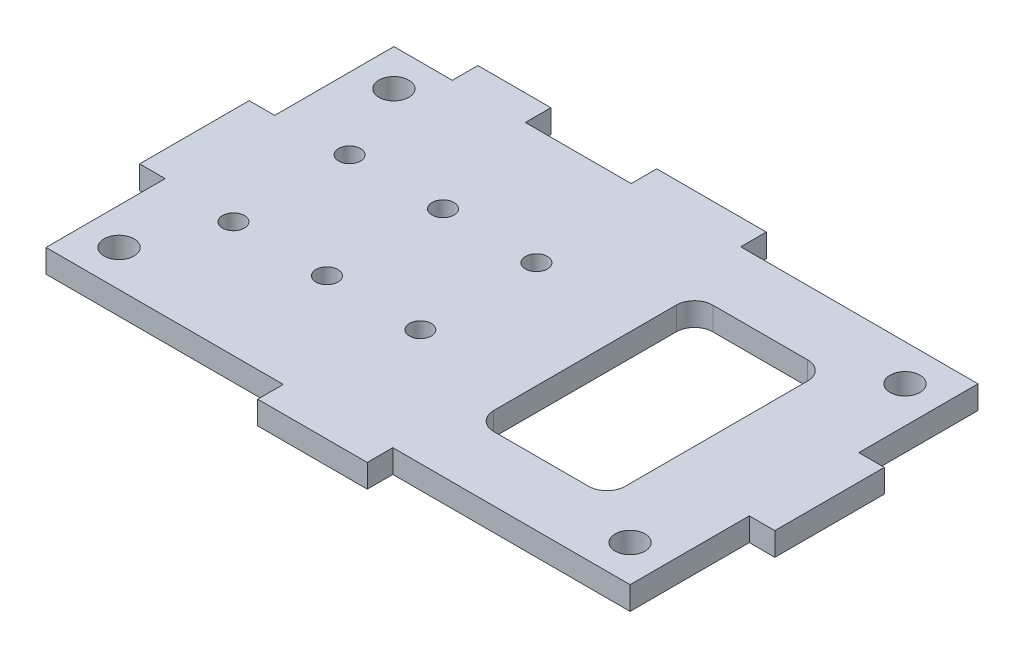
from build123d import *

# Parameters (mm, degrees)
SKETCH2_W               = 80
SKETCH2_H               = 47.65
BOSS_EXTRUDE1_DEPTH     = 3.175
SKETCH3_W               = 15
SKETCH3_H               = 3.5
BOSS_EXTRUDE2_DEPTH     = 3.175
SKETCH4_W               = 3.5
SKETCH4_H               = 15
BOSS_EXTRUDE3_DEPTH     = 3.175
MIRROR2_COPY_1_SKETCH_W = 3.5
MIRROR2_COPY_1_SKETCH_H = 15
MIRROR2_COPY_1_DEPTH    = 3.175
MIRROR2_COPY_2_SKETCH_W = 3.5
MIRROR2_COPY_2_SKETCH_H = 15
MIRROR2_COPY_2_DEPTH    = 3.175
SKETCH5_R               = 2.05
CUT_EXTRUDE1_DEPTH      = 20
SKETCH6_W               = 18
SKETCH6_H               = 30
CUT_EXTRUDE2_DEPTH      = 52.468303353
FILLET1_R               = 2.5
MIRROR4_COPY_1_SKETCH_R = 2.05
MIRROR4_COPY_1_DEPTH    = 20
SKETCH8_R               = 1.5
CUT_EXTRUDE4_DEPTH      = 10
LPATTERN1_COUNT         = 3
LPATTERN1_PITCH         = 12.8
MIRROR5_COPY_1_SKETCH_R = 1.5
MIRROR5_COPY_1_DEPTH    = 10
MIRROR5_COPY_2_SKETCH_R = 1.5
MIRROR5_COPY_2_DEPTH    = 10
SKETCH9_W               = 10
SKETCH9_H               = 3.5
BOSS_EXTRUDE4_DEPTH     = 3.175


with BuildPart() as part:
    # Sketch2 → Boss-Extrude1 (new body)
    with BuildSketch(Plane(origin=(0, 0, 0), x_dir=(1, 0, 0), z_dir=(0, 1, 0))):
        Rectangle(SKETCH2_W, SKETCH2_H)
    extrude(amount=BOSS_EXTRUDE1_DEPTH)

    # Sketch3 → Boss-Extrude2 (add)
    with BuildSketch(Plane(origin=(0, 3.175, 0), x_dir=(1, 0, 0), z_dir=(0, 1, 0))):
        with Locations((0, 25.575)):
            Rectangle(SKETCH3_W, SKETCH3_H)
    boss_extrude2 = extrude(amount=-BOSS_EXTRUDE2_DEPTH)

    # Sketch4 → Boss-Extrude3 (add)
    with BuildSketch(Plane(origin=(0, 3.175, 0), x_dir=(1, 0, 0), z_dir=(0, 1, 0))):
        with Locations((-41.75, 0)):
            Rectangle(SKETCH4_W, SKETCH4_H)
    boss_extrude3 = extrude(amount=-BOSS_EXTRUDE3_DEPTH)

    # Mirror1: Boss-Extrude3 across plane
    add(boss_extrude3.mirror(Plane(origin=(0, 0, 0), x_dir=(0, 0, 1), z_dir=(1, 0, 0))))

    # Mirror2: Boss-Extrude2 across plane
    add(boss_extrude2.mirror(Plane.XY))

    # Mirror2 copy 1 sketch → Mirror2 copy 1 (add)
    with BuildSketch(Plane(origin=(0, 3.175, 0), x_dir=(-1, 0, 0), z_dir=(0, 1, 0))):
        with Locations((-41.75, 0)):
            Rectangle(MIRROR2_COPY_1_SKETCH_W, MIRROR2_COPY_1_SKETCH_H)
    extrude(amount=-MIRROR2_COPY_1_DEPTH)

    # Mirror2 copy 2 sketch → Mirror2 copy 2 (add)
    with BuildSketch(Plane(origin=(0, 3.175, 0), x_dir=(1, 0, 0), z_dir=(0, 1, 0))):
        with Locations((-41.75, 0)):
            Rectangle(MIRROR2_COPY_2_SKETCH_W, MIRROR2_COPY_2_SKETCH_H)
    extrude(amount=-MIRROR2_COPY_2_DEPTH)

    # Sketch5 → Cut-Extrude1 (cut)
    with BuildSketch(Plane(origin=(0, 3.175, 0), x_dir=(1, 0, 0), z_dir=(0, 1, 0))):
        with Locations(Location((-35, 18.825, 0), (0, 0, 270))):
            Circle(SKETCH5_R)
    cut_extrude1 = extrude(amount=-CUT_EXTRUDE1_DEPTH, mode=Mode.SUBTRACT)

    # Sketch6 → Cut-Extrude2 (cut, through all)
    with BuildSketch(Plane(origin=(0, 3.175, 0), x_dir=(1, 0, 0), z_dir=(0, 1, 0))):
        with Locations((19, 0)):
            Rectangle(SKETCH6_W, SKETCH6_H)
    extrude(amount=-CUT_EXTRUDE2_DEPTH, mode=Mode.SUBTRACT)

    # Fillet1
    fillet1_edges = [part.edges().sort_by_distance(p)[0] for p in [
        (10, 1.5875, 15),
        (10, 1.5875, -15),
        (28, 1.5875, -15),
        (28, 1.5875, 15),
    ]]
    fillet(fillet1_edges, radius=FILLET1_R)

    # Mirror3: Cut-Extrude1 across plane
    add(cut_extrude1.mirror(Plane(origin=(0, 0, 0), x_dir=(0, 0, 1), z_dir=(1, 0, 0))), mode=Mode.SUBTRACT)

    # Mirror4: Cut-Extrude1 across plane
    add(cut_extrude1.mirror(Plane.XY), mode=Mode.SUBTRACT)

    # Mirror4 copy 1 sketch → Mirror4 copy 1 (cut)
    with BuildSketch(Plane(origin=(0, 3.175, 0), x_dir=(-1, 0, 0), z_dir=(0, 1, 0))):
        with Locations(Location((-35, 18.825, 0), (0, 0, 270))):
            Circle(MIRROR4_COPY_1_SKETCH_R)
    extrude(amount=-MIRROR4_COPY_1_DEPTH, mode=Mode.SUBTRACT)

    # Sketch8 → Cut-Extrude4 (cut)
    with BuildSketch(Plane(origin=(0, 3.175, 0), x_dir=(1, 0, 0), z_dir=(0, 1, 0))):
        with Locations(Location((-30.2, 7.95, 0), (0, 0, 270))):
            Circle(SKETCH8_R)
    cut_extrude4 = extrude(amount=-CUT_EXTRUDE4_DEPTH, mode=Mode.SUBTRACT)

    # LPattern1: Cut-Extrude4 ×3
    with Locations(*[(i * LPATTERN1_PITCH, 0, 0) for i in range(1, LPATTERN1_COUNT)]):
        add(cut_extrude4, mode=Mode.SUBTRACT)

    # Mirror5: Cut-Extrude4 across plane
    add(cut_extrude4.mirror(Plane.XY), mode=Mode.SUBTRACT)

    # Mirror5 copy 1 sketch → Mirror5 copy 1 (cut)
    with BuildSketch(Plane(origin=(12.8, 3.175, 0), x_dir=(1, 0, 0), z_dir=(0, 1, 0))):
        with Locations((-30.2, -7.95)):
            Circle(MIRROR5_COPY_1_SKETCH_R)
    extrude(amount=-MIRROR5_COPY_1_DEPTH, mode=Mode.SUBTRACT)

    # Mirror5 copy 2 sketch → Mirror5 copy 2 (cut)
    with BuildSketch(Plane(origin=(25.6, 3.175, 0), x_dir=(1, 0, 0), z_dir=(0, 1, 0))):
        with Locations((-30.2, -7.95)):
            Circle(MIRROR5_COPY_2_SKETCH_R)
    extrude(amount=-MIRROR5_COPY_2_DEPTH, mode=Mode.SUBTRACT)

    # Sketch9 → Boss-Extrude4 (add)
    with BuildSketch(Plane(origin=(0, 0, 0), x_dir=(1, 0, 0), z_dir=(0, 1, 0))):
        with Locations((-27, 25.575)):
            Rectangle(SKETCH9_W, SKETCH9_H)
    extrude(amount=BOSS_EXTRUDE4_DEPTH)


solid = part.part
